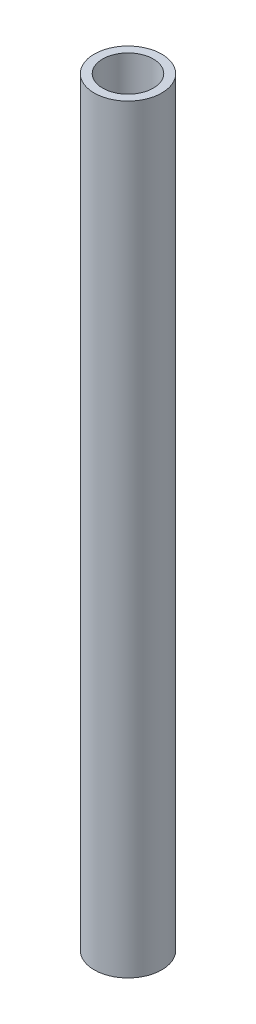
from build123d import *

# Parameters (mm, degrees)
SKETCH_1_R      = 2
SKETCH_1_R_2    = 1.5
EXTRUDE_1_DEPTH = 40
SKETCH_2_R      = 2
SKETCH_2_R_2    = 1.5
EXTRUDE_3_DEPTH = 5


with BuildPart() as part:
    # 草图1 → 凸台-拉伸1 (new body)
    with BuildSketch(Plane(origin=(0, 0, 0), x_dir=(1, 0, 0), z_dir=(0, 1, 0))):
        with Locations(Location((0, 0, 0), (0, 0, 270))):
            Circle(SKETCH_1_R)
        with Locations(Location((0, 0, 0), (0, 0, 270))):
            Circle(SKETCH_1_R_2, mode=Mode.SUBTRACT)
    extrude(amount=EXTRUDE_1_DEPTH)

    # 草图2 → 凸台-拉伸3 (add)
    with BuildSketch(Plane(origin=(0, 40, 0), x_dir=(1, 0, 0), z_dir=(0, 1, 0))):
        with Locations(Location((0, 0, 0), (0, 0, 270))):
            Circle(SKETCH_2_R)
        with Locations(Location((0, 0, 0), (0, 0, 270))):
            Circle(SKETCH_2_R_2, mode=Mode.SUBTRACT)
    extrude(amount=EXTRUDE_3_DEPTH)


solid = part.part
